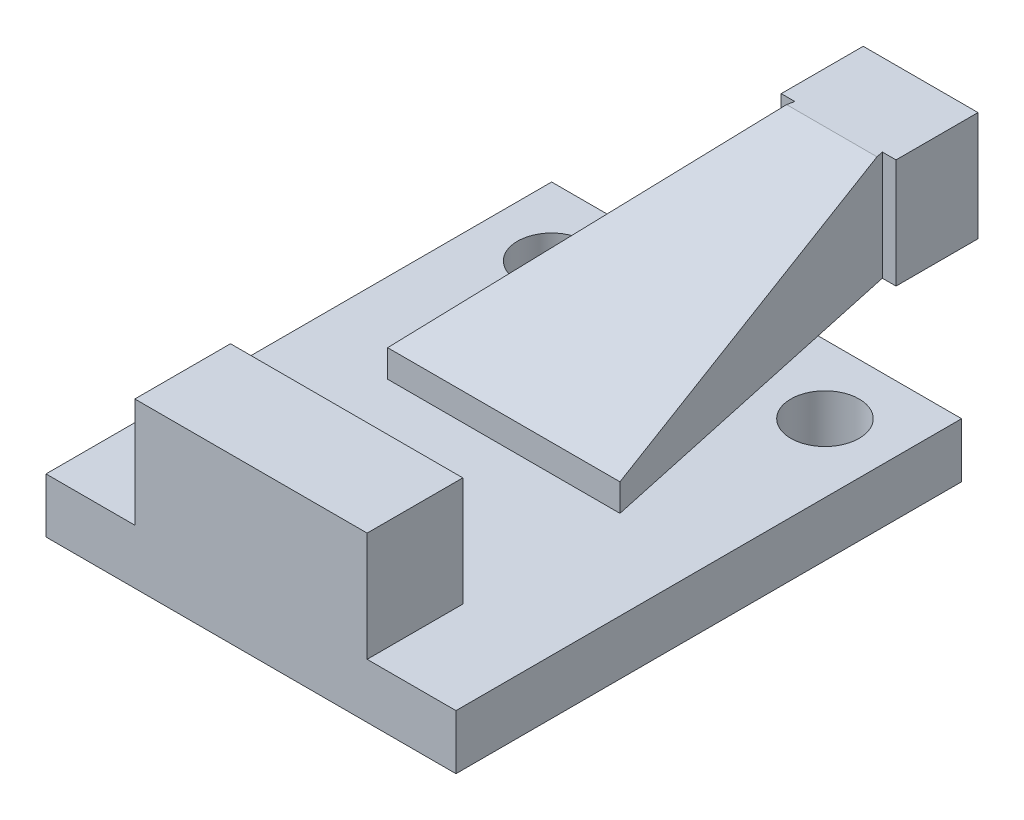
from build123d import *

# Parameters (mm, degrees)
SKETCH1_W           = 15
SKETCH1_H           = 18.5
SKETCH1_R           = 1.25
BOSS_EXTRUDE1_DEPTH = 2
SKETCH2_W           = 8.5
SKETCH2_H           = 3.5
BOSS_EXTRUDE2_DEPTH = 4
CHAMFER1_SIZE       = 3
CHAMFER1_SIZE2      = 12


with BuildPart() as part:
    # Sketch1 → Boss-Extrude1 (new body)
    with BuildSketch(Plane(origin=(0, 0, 0), x_dir=(1, 0, 0), z_dir=(0, 1, 0))):
        with Locations((7.5, 9.25)):
            Rectangle(SKETCH1_W, SKETCH1_H)
        with Locations(Location((2.5, 16, 0), (0, 0, 270))):
            Circle(SKETCH1_R, mode=Mode.SUBTRACT)
        with Locations(Location((12.5, 16, 0), (0, 0, 90))):
            Circle(SKETCH1_R, mode=Mode.SUBTRACT)
    extrude(amount=BOSS_EXTRUDE1_DEPTH)

    # Sketch2 → Boss-Extrude2 (add)
    with BuildSketch(Plane(origin=(0, 2, 0), x_dir=(1, 0, 0), z_dir=(0, 1, 0))):
        with Locations((7.5, 1.75)):
            Rectangle(SKETCH2_W, SKETCH2_H)
        Polygon((3.25, 9.25), (11.75, 9.25), (9.1, 21.5), (9.6, 21.5), (9.6, 24.5), (5.4, 24.5), (5.4, 21.5), (5.9, 21.5), align=None)
    extrude(amount=BOSS_EXTRUDE2_DEPTH)

    # Chamfer1
    chamfer1_edges = [part.edges().sort_by_distance(p)[0] for p in [
        (7.5, 6, -9.25),
    ]]
    chamfer1_side = [part.faces().sort_by_distance(p)[0] for p in [
        (7.5, 4, -9.25),
    ]]
    chamfer(chamfer1_edges, length=CHAMFER1_SIZE, length2=CHAMFER1_SIZE2, reference=chamfer1_side[0])


solid = part.part
